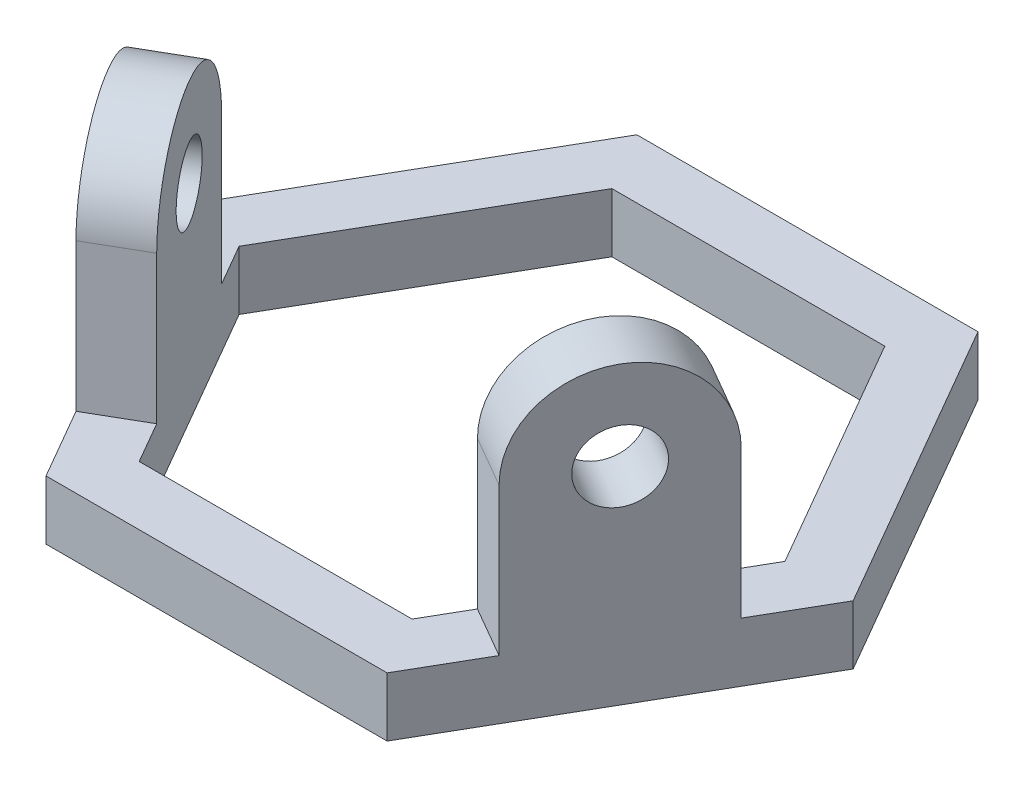
from build123d import *

# Parameters (mm, degrees)
BOSS_EXTRUDE1_DEPTH = 10
SKETCH3_R           = 6
BOSS_EXTRUDE2_DEPTH = 10


with BuildPart() as part:
    # Sketch1 → Boss-Extrude1 (new body)
    with BuildSketch(Plane(origin=(0, 0, 0), x_dir=(1, 0, 0), z_dir=(0, 1, 0))):
        Polygon((57.735026919, 0), (28.867513459, 50), (-28.867513459, 50), (-57.735026919, 0), (-28.867513459, -50), (28.867513459, -50), align=None)
        Polygon((46.188021535, 0), (23.094010768, 40), (-23.094010768, 40), (-46.188021535, 0), (-23.094010768, -40), (23.094010768, -40), align=None, mode=Mode.SUBTRACT)
    extrude(amount=BOSS_EXTRUDE1_DEPTH)

    # Sketch3 → Boss-Extrude2 (add)
    with BuildSketch(Plane(origin=(43.301270189, 0, 25), x_dir=(0.5000000000000004, 0, -0.8660254037844384), z_dir=(0.8660254037844384, 0, 0.5000000000000004))):
        with BuildLine():
            Line((-15, 10), (-15, 35))
            ThreePointArc((-15, 35), (0, 50), (15, 35))
            Line((15, 35), (15, 10))
            Line((15, 10), (-15, 10))
        make_face()
        with Locations((0, 35)):
            Circle(SKETCH3_R, mode=Mode.SUBTRACT)
    boss_extrude2 = extrude(amount=-BOSS_EXTRUDE2_DEPTH)

    # Mirror1: Boss-Extrude2 across plane
    add(boss_extrude2.mirror(Plane(origin=(0, 0, 0), x_dir=(0, 0, 1), z_dir=(1, 0, 0))))


solid = part.part
